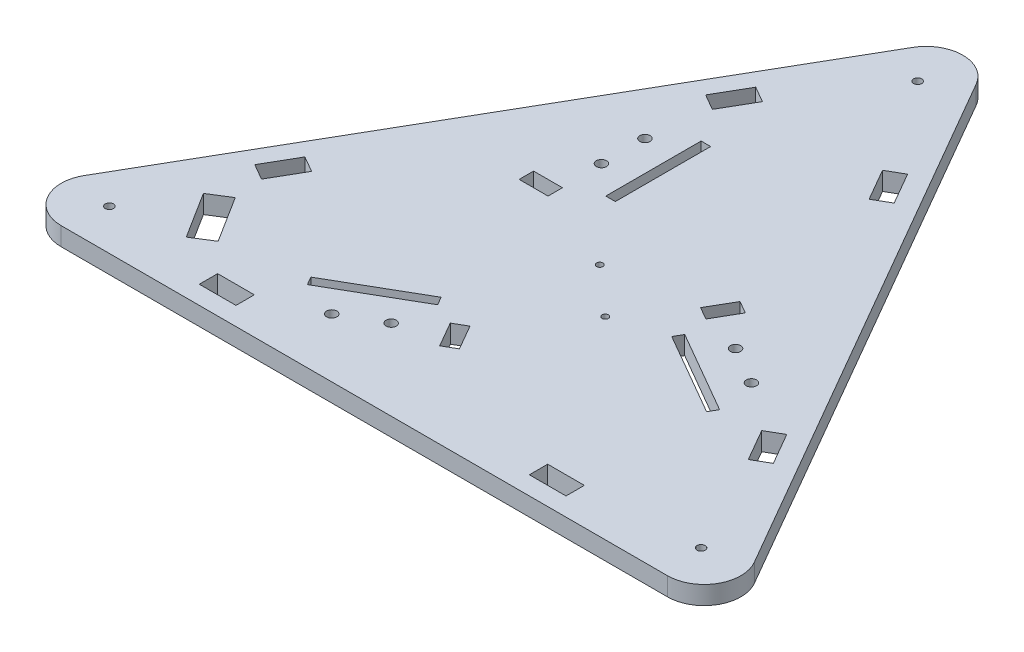
from build123d import *

# Parameters (mm, degrees)
BOSS_EXTRUDE1_DEPTH = 6.35
SKETCH2_W           = 3.302
SKETCH2_H           = 33.02
SKETCH2_R           = 1.778
CUT_EXTRUDE1_DEPTH  = 195.099602868
SKETCH3_R           = 1.4224
SKETCH3_W           = 10
SKETCH3_H           = 5
CUT_EXTRUDE2_DEPTH  = 195.099602868
SKETCH4_R           = 1.0922
CUT_EXTRUDE3_DEPTH  = 195.099602868
FILLET1_R           = 12.7
SKETCH5_W           = 12.7
SKETCH5_H           = 6.35
CUT_EXTRUDE4_DEPTH  = 179.426731159
CUT_EXTRUDE5_DEPTH  = 179.426731159


with BuildPart() as part:
    # Sketch1 → Boss-Extrude1 (new body)
    with BuildSketch(Plane(origin=(0, 0, 0), x_dir=(1, 0, 0), z_dir=(0, 1, 0))):
        Polygon((0, 146.646968374), (-127, -73.323484187), (127, -73.323484187), align=None)
    extrude(amount=BOSS_EXTRUDE1_DEPTH)

    # Sketch2 → Cut-Extrude1 (cut, through all)
    with BuildSketch(Plane(origin=(0, 6.35, 0), x_dir=(1, 0, 0), z_dir=(0, 1, 0))):
        with Locations((-17.907, 46.362701567)):
            Rectangle(SKETCH2_W, SKETCH2_H)
        Polygon((64.228356761, -14.498625936), (35.632197928, 2.011374064), (33.981197928, -0.848241819), (62.577356761, -17.358241819), align=None)
        with Locations(Location((48.644716778, 6.588823684, 0), (0, 0, 270))):
            Circle(SKETCH2_R)
        with Locations(Location((61.686284992, -0.940729235, 0), (0, 0, 270))):
            Circle(SKETCH2_R)
        with Locations(Location((-30.028447081, 38.833148648, 0), (0, 0, 270))):
            Circle(SKETCH2_R)
        with Locations(Location((-30.028447081, 53.892254486, 0), (0, 0, 270))):
            Circle(SKETCH2_R)
        Polygon((-16.074197928, -31.864075631), (-17.725197928, -29.004459747), (-46.321356761, -45.514459747), (-44.670356761, -48.374075631), align=None)
        with Locations(Location((-18.616269697, -45.421972332, 0), (0, 0, 270))):
            Circle(SKETCH2_R)
        with Locations(Location((-31.657837912, -52.951525251, 0), (0, 0, 270))):
            Circle(SKETCH2_R)
    extrude(amount=-CUT_EXTRUDE1_DEPTH, mode=Mode.SUBTRACT)

    # Sketch3 → Cut-Extrude2 (cut, through all)
    with BuildSketch(Plane(origin=(0, 6.35, 0), x_dir=(1, 0, 0), z_dir=(0, 1, 0))):
        with Locations(Location((0, 118.312139176, 0), (0, 0, 270))):
            Circle(SKETCH3_R)
        with Locations(Location((-102.461318102, -59.156069588, 0), (0, 0, 270))):
            Circle(SKETCH3_R)
        with Locations(Location((102.461318102, -59.156069588, 0), (0, 0, 270))):
            Circle(SKETCH3_R)
        with Locations((-34.558, 22.352701567)):
            Rectangle(SKETCH3_W, SKETCH3_H)
        Polygon((0.935056109, -41.324967823), (-4.064943891, -32.664713785), (-8.395070909, -35.164713785), (-3.395070909, -43.824967823), align=None)
        Polygon((35.320943891, 21.472266256), (30.320943891, 12.812012218), (34.651070909, 10.312012218), (39.651070909, 18.972266256), align=None)
    extrude(amount=-CUT_EXTRUDE2_DEPTH, mode=Mode.SUBTRACT)

    # Sketch4 → Cut-Extrude3 (cut, through all)
    with BuildSketch(Plane(origin=(0, 6.35, 0), x_dir=(1, 0, 0), z_dir=(0, 1, 0))):
        with Locations(Location((0, 8.207705491, 0), (0, 0, 270))):
            Circle(SKETCH4_R)
        with Locations(Location((16.51, -6.397294509, 0), (0, 0, 270))):
            Circle(SKETCH4_R)
    extrude(amount=-CUT_EXTRUDE3_DEPTH, mode=Mode.SUBTRACT)

    # Fillet1
    fillet1_edges = [part.edges().sort_by_distance(p)[0] for p in [
        (127, 3.175, 73.323484187),
        (-127, 3.175, 73.323484187),
        (0, 3.175, -146.646968374),
    ]]
    fillet(fillet1_edges, radius=FILLET1_R)

    # Sketch5 → Cut-Extrude4 (cut, through all)
    with BuildSketch(Plane(origin=(0, 6.35, 0), x_dir=(1, 0, 0), z_dir=(0, 1, 0))):
        with Locations((-57.15, -63.798484187)):
            Rectangle(SKETCH5_W, SKETCH5_H)
        with Locations((57.15, -63.798484187)):
            Rectangle(SKETCH5_W, SKETCH5_H)
        Polygon((89.632293954, -21.300718754), (83.282293954, -10.302196126), (77.78303264, -13.477196126), (84.13303264, -24.475718754), align=None)
        Polygon((26.98303264, 74.510984899), (32.482293954, 77.685984899), (26.132293954, 88.684507527), (20.63303264, 85.509507527), align=None)
        Polygon((-26.250738686, 88.479355234), (-32.600738686, 77.480832606), (-27.101477372, 74.305832606), (-20.751477372, 85.304355234), align=None)
        Polygon((-77.901477372, -13.682348419), (-83.400738686, -10.507348419), (-89.750738686, -21.505871047), (-84.251477372, -24.680871047), align=None)
    extrude(amount=-CUT_EXTRUDE4_DEPTH, mode=Mode.SUBTRACT)

    # Sketch6 → Cut-Extrude5 (cut, through all)
    with BuildSketch(Plane(origin=(0, 6.35, 0), x_dir=(1, 0, 0), z_dir=(0, 1, 0))):
        Polygon((-73.125150775, -50.833442097), (-83.259043602, -34.761596647), (-90.026136423, -39.02849889), (-79.892243597, -55.10034434), align=None)
    extrude(amount=-CUT_EXTRUDE5_DEPTH, mode=Mode.SUBTRACT)


solid = part.part
